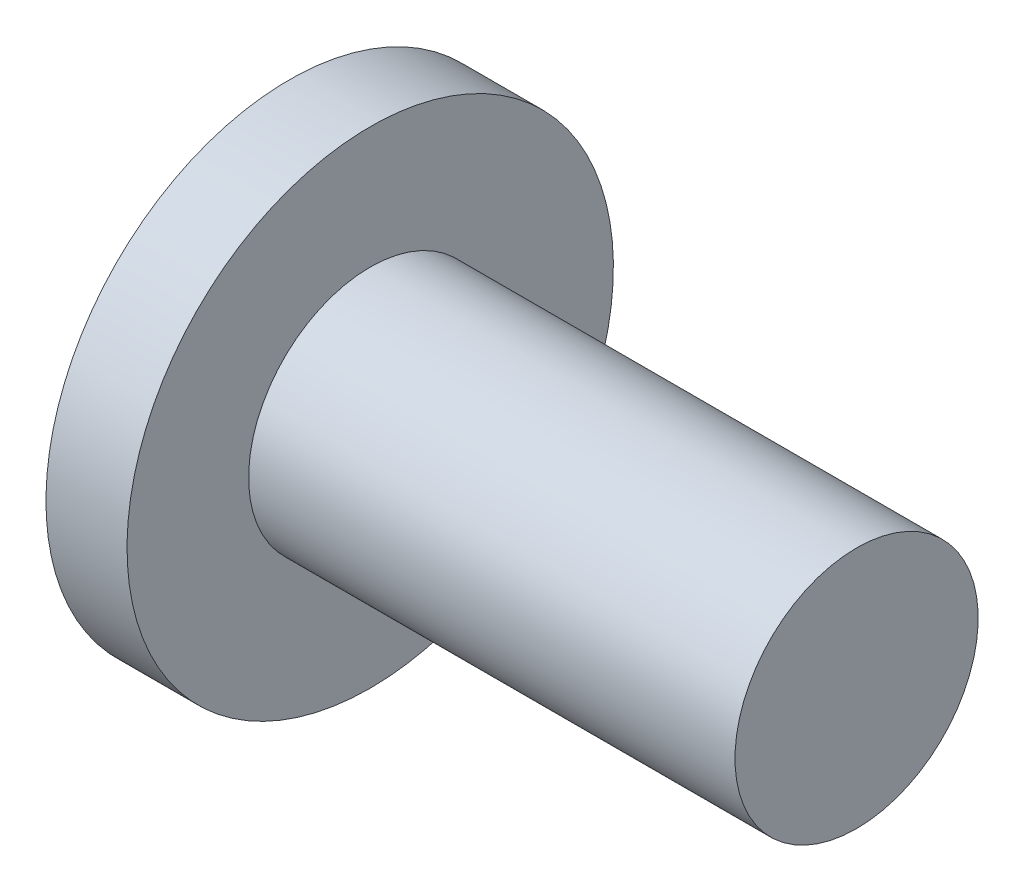
from build123d import *


with BuildPart() as part:
    # 草图1 → 旋转1 (revolve)
    with BuildSketch(Plane.XY, mode=Mode.PRIVATE) as revolve_1_sk:
        Polygon((0, 0), (6, 0), (6, -1.5), (-1, -1.5), (-1, 1.5), (0, 1.5), align=None)
    revolve(revolve_1_sk.sketch.rotate(Axis((-1, -1.5, 0), (1, 0, 0)), 180), axis=Axis((-1, -1.5, 0), (1, 0, 0)))


solid = part.part
